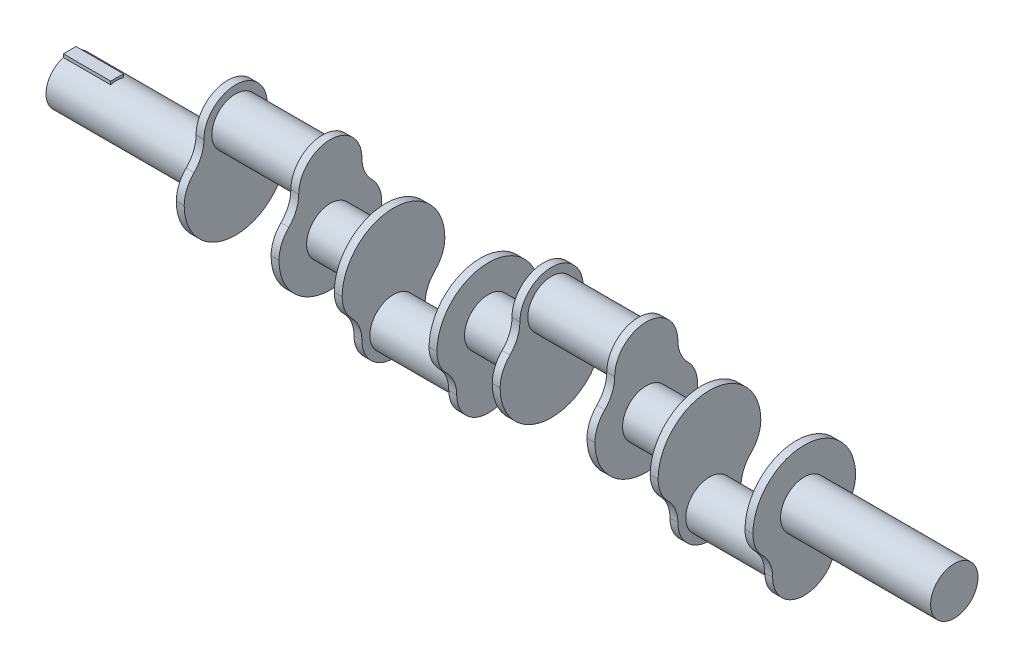
from build123d import *

# Parameters (mm, degrees)
BOSS_EXTRUDE1_DEPTH       = 320
BOSS_EXTRUDE1_DEPTH_BACK  = 240
SKETCH1_R                 = 15
BOSS_EXTRUDE2_DEPTH       = 2.5
BOSS_EXTRUDE2_DEPTH_BACK  = 2.5
BOSS_EXTRUDE2_START       = -20
BOSS_EXTRUDE4_DEPTH       = 2.5
BOSS_EXTRUDE4_DEPTH_BACK  = 2.5
BOSS_EXTRUDE4_START       = 20
BOSS_EXTRUDE5_DEPTH       = 2.5
BOSS_EXTRUDE5_DEPTH_BACK  = 2.5
BOSS_EXTRUDE5_START       = -20
SKETCH7_R                 = 15
CUT_EXTRUDE1_DEPTH        = 55
SKETCH6_R                 = 15
BOSS_EXTRUDE6_DEPTH       = 55
BOSS_EXTRUDE7_DEPTH       = 2.5
BOSS_EXTRUDE7_DEPTH_BACK  = 2.5
BOSS_EXTRUDE7_START       = 20
BOSS_EXTRUDE8_DEPTH       = 2.5
BOSS_EXTRUDE8_DEPTH_BACK  = 2.5
BOSS_EXTRUDE8_START       = -20
SKETCH11_R                = 15
CUT_EXTRUDE2_DEPTH        = 55
SKETCH10_R                = 15
BOSS_EXTRUDE11_DEPTH      = 55
BOSS_EXTRUDE12_DEPTH      = 2.5
BOSS_EXTRUDE12_DEPTH_BACK = 2.5
BOSS_EXTRUDE12_START      = 20
BOSS_EXTRUDE13_DEPTH      = 2.5
BOSS_EXTRUDE13_DEPTH_BACK = 2.5
BOSS_EXTRUDE13_START      = 80
SKETCH15_R                = 15
CUT_EXTRUDE3_DEPTH        = 55
SKETCH14_R                = 15
BOSS_EXTRUDE14_DEPTH      = 55
BOSS_EXTRUDE15_DEPTH      = 2.5
BOSS_EXTRUDE15_DEPTH_BACK = 2.5
BOSS_EXTRUDE15_START      = -80
SKETCH19_R                = 15
CUT_EXTRUDE4_DEPTH        = 55
BOSS_EXTRUDE16_REACH      = 460.891
SKETCH18_R                = 15
SKETCH23_W                = 8
SKETCH23_H                = 6
BOSS_EXTRUDE17_DEPTH      = 30


with BuildPart() as part:
    # Sketch1 → Boss-Extrude1 (new, two sides: drawn at the far end of the back side and taken through both)
    with BuildSketch(Plane(origin=(0, 0, 0), x_dir=(0, 0, -1), z_dir=(1, 0, 0)).offset(-BOSS_EXTRUDE1_DEPTH_BACK)):
        Circle(SKETCH1_R)
    extrude(amount=BOSS_EXTRUDE1_DEPTH + BOSS_EXTRUDE1_DEPTH_BACK)

    # Sketch3 → Boss-Extrude2 (add, two sides: drawn at the far end of the back side and taken through both)
    with BuildSketch(Plane(origin=(-57.5, 0, 0), x_dir=(0, 0, -1), z_dir=(1, 0, 0)).offset(BOSS_EXTRUDE2_START - BOSS_EXTRUDE2_DEPTH_BACK)):
        with BuildLine():
            ThreePointArc((-32.5, 0), (0, -32.5), (32.5, 0))
            ThreePointArc((32.5, 0), (30.875, 8.125), (26.25, 15))
            ThreePointArc((26.25, 15), (21.625, 21.875), (20, 30))
            ThreePointArc((20, 30), (0, 50), (-20, 30))
            ThreePointArc((-20, 30), (-21.625, 21.875), (-26.25, 15))
            ThreePointArc((-26.25, 15), (-30.875, 8.125), (-32.5, 0))
        make_face()
    extrude(amount=BOSS_EXTRUDE2_DEPTH + BOSS_EXTRUDE2_DEPTH_BACK)

    # Sketch4 → Boss-Extrude4 (add, two sides: drawn at the far end of the back side and taken through both)
    with BuildSketch(Plane(origin=(-57.5, 0, 0), x_dir=(0, 0, -1), z_dir=(1, 0, 0)).offset(BOSS_EXTRUDE4_START - BOSS_EXTRUDE4_DEPTH_BACK)):
        with BuildLine():
            ThreePointArc((-32.5, 0), (0, 32.5), (32.5, 0))
            ThreePointArc((32.5, 0), (30.875, -8.125), (26.25, -15))
            ThreePointArc((26.25, -15), (21.625, -21.875), (20, -30))
            ThreePointArc((20, -30), (0, -50), (-20, -30))
            ThreePointArc((-20, -30), (-21.625, -21.875), (-26.25, -15))
            ThreePointArc((-26.25, -15), (-30.875, -8.125), (-32.5, 0))
        make_face()
    extrude(amount=BOSS_EXTRUDE4_DEPTH + BOSS_EXTRUDE4_DEPTH_BACK)

    # Sketch5 → Boss-Extrude5 (add, two sides: drawn at the far end of the back side and taken through both)
    with BuildSketch(Plane(origin=(42.5, 0, 0), x_dir=(0, 0, -1), z_dir=(1, 0, 0)).offset(BOSS_EXTRUDE5_START - BOSS_EXTRUDE5_DEPTH_BACK)):
        with BuildLine():
            ThreePointArc((-32.5, 0), (0, 32.5), (32.5, 0))
            ThreePointArc((32.5, 0), (30.875, -8.125), (26.25, -15))
            ThreePointArc((26.25, -15), (21.625, -21.875), (20, -30))
            ThreePointArc((20, -30), (0, -50), (-20, -30))
            ThreePointArc((-20, -30), (-21.625, -21.875), (-26.25, -15))
            ThreePointArc((-26.25, -15), (-30.875, -8.125), (-32.5, 0))
        make_face()
    extrude(amount=BOSS_EXTRUDE5_DEPTH + BOSS_EXTRUDE5_DEPTH_BACK)

    # Sketch7 → Cut-Extrude1 (cut)
    with BuildSketch(Plane(origin=(-35, 0, 0), x_dir=(0, 0, -1), z_dir=(1, 0, 0))):
        Circle(SKETCH7_R)
    extrude(amount=CUT_EXTRUDE1_DEPTH, mode=Mode.SUBTRACT)


with BuildPart() as cut_extrude1_piece_1:
    # of the separate pieces the step leaves, piece 1, a body of its own (cut_extrude1_pieces)
    add(part.part.solids().sort_by_distance((20, -15, 26.25))[0])



with BuildPart() as cut_extrude1_piece_2:
    # of the separate pieces the step leaves, piece 2, a body of its own (cut_extrude1_pieces)
    add(part.part.solids().sort_by_distance((-35, -15, 26.25))[0])


with BuildPart() as cut_extrude1_piece_1_1:
    add(cut_extrude1_piece_1.part)

    add(cut_extrude1_piece_2.part)  # Boss-Extrude6 merges Cut-Extrude1 piece 2
    # Sketch6 → Boss-Extrude6 (add)
    with BuildSketch(Plane(origin=(-35, 0, 0), x_dir=(0, 0, -1), z_dir=(1, 0, 0))):
        with Locations(Location((0, -30, 0), (0, 0, 180))):
            Circle(SKETCH6_R)
    extrude(amount=BOSS_EXTRUDE6_DEPTH)

    # Sketch8 → Boss-Extrude7 (add, two sides: drawn at the far end of the back side and taken through both)
    with BuildSketch(Plane(origin=(42.5, 0, 0), x_dir=(0, 0, -1), z_dir=(1, 0, 0)).offset(BOSS_EXTRUDE7_START - BOSS_EXTRUDE7_DEPTH_BACK)):
        with BuildLine():
            ThreePointArc((-20, 30), (0, 50), (20, 30))
            ThreePointArc((20, 30), (21.625, 21.875), (26.25, 15))
            ThreePointArc((26.25, 15), (30.875, 8.125), (32.5, 0))
            ThreePointArc((32.5, 0), (0, -32.5), (-32.5, 0))
            ThreePointArc((-32.5, 0), (-30.875, 8.125), (-26.25, 15))
            ThreePointArc((-26.25, 15), (-21.625, 21.875), (-20, 30))
        make_face()
    extrude(amount=BOSS_EXTRUDE7_DEPTH + BOSS_EXTRUDE7_DEPTH_BACK)

    # Sketch9 → Boss-Extrude8 (add, two sides: drawn at the far end of the back side and taken through both)
    with BuildSketch(Plane(origin=(142.5, 0, 0), x_dir=(0, 0, -1), z_dir=(1, 0, 0)).offset(BOSS_EXTRUDE8_START - BOSS_EXTRUDE8_DEPTH_BACK)):
        with BuildLine():
            ThreePointArc((-20, 30), (0, 50), (20, 30))
            ThreePointArc((20, 30), (21.625, 21.875), (26.25, 15))
            ThreePointArc((26.25, 15), (30.875, 8.125), (32.5, 0))
            ThreePointArc((32.5, 0), (0, -32.5), (-32.5, 0))
            ThreePointArc((-32.5, 0), (-30.875, 8.125), (-26.25, 15))
            ThreePointArc((-26.25, 15), (-21.625, 21.875), (-20, 30))
        make_face()
    extrude(amount=BOSS_EXTRUDE8_DEPTH + BOSS_EXTRUDE8_DEPTH_BACK)

    # Sketch11 → Cut-Extrude2 (cut)
    with BuildSketch(Plane(origin=(65, 0, 0), x_dir=(0, 0, -1), z_dir=(1, 0, 0))):
        Circle(SKETCH11_R)
    extrude(amount=CUT_EXTRUDE2_DEPTH, mode=Mode.SUBTRACT)


with BuildPart() as cut_extrude2_piece_1:
    # of the separate pieces the step leaves, piece 1, a body of its own (cut_extrude2_pieces)
    add(cut_extrude1_piece_1_1.part.solids().sort_by_distance((-35, -15, 26.25))[0])



with BuildPart() as cut_extrude2_piece_2:
    # of the separate pieces the step leaves, piece 2, a body of its own (cut_extrude2_pieces)
    add(cut_extrude1_piece_1_1.part.solids().sort_by_distance((120, 0, 32.5))[0])


with BuildPart() as cut_extrude2_piece_1_1:
    add(cut_extrude2_piece_1.part)

    add(cut_extrude2_piece_2.part)  # Boss-Extrude11 merges Cut-Extrude2 piece 2
    # Sketch10 → Boss-Extrude11 (add)
    with BuildSketch(Plane(origin=(65, 0, 0), x_dir=(0, 0, -1), z_dir=(1, 0, 0))):
        with Locations((0, 30)):
            Circle(SKETCH10_R)
    extrude(amount=BOSS_EXTRUDE11_DEPTH)

    # Sketch12 → Boss-Extrude12 (add, two sides: drawn at the far end of the back side and taken through both)
    with BuildSketch(Plane(origin=(142.5, 0, 0), x_dir=(0, 0, -1), z_dir=(1, 0, 0)).offset(BOSS_EXTRUDE12_START - BOSS_EXTRUDE12_DEPTH_BACK)):
        with BuildLine():
            ThreePointArc((-20, -30), (0, -50), (20, -30))
            ThreePointArc((20, -30), (21.625, -21.875), (26.25, -15))
            ThreePointArc((26.25, -15), (30.875, -8.125), (32.5, 0))
            ThreePointArc((32.5, 0), (0, 32.5), (-32.5, 0))
            ThreePointArc((-32.5, 0), (-30.875, -8.125), (-26.25, -15))
            ThreePointArc((-26.25, -15), (-21.625, -21.875), (-20, -30))
        make_face()
    extrude(amount=BOSS_EXTRUDE12_DEPTH + BOSS_EXTRUDE12_DEPTH_BACK)

    # Sketch13 → Boss-Extrude13 (add, two sides: drawn at the far end of the back side and taken through both)
    with BuildSketch(Plane(origin=(142.5, 0, 0), x_dir=(0, 0, -1), z_dir=(1, 0, 0)).offset(BOSS_EXTRUDE13_START - BOSS_EXTRUDE13_DEPTH_BACK)):
        with BuildLine():
            ThreePointArc((-32.5, 0), (0, 32.5), (32.5, 0))
            ThreePointArc((32.5, 0), (30.875, -8.125), (26.25, -15))
            ThreePointArc((26.25, -15), (21.625, -21.875), (20, -30))
            ThreePointArc((20, -30), (0, -50), (-20, -30))
            ThreePointArc((-20, -30), (-21.625, -21.875), (-26.25, -15))
            ThreePointArc((-26.25, -15), (-30.875, -8.125), (-32.5, 0))
        make_face()
    extrude(amount=BOSS_EXTRUDE13_DEPTH + BOSS_EXTRUDE13_DEPTH_BACK)

    # Sketch15 → Cut-Extrude3 (cut)
    with BuildSketch(Plane(origin=(165, 0, 0), x_dir=(0, 0, -1), z_dir=(1, 0, 0))):
        Circle(SKETCH15_R)
    extrude(amount=CUT_EXTRUDE3_DEPTH, mode=Mode.SUBTRACT)


with BuildPart() as cut_extrude3_piece_1:
    # of the separate pieces the step leaves, piece 1, a body of its own (cut_extrude3_pieces)
    add(cut_extrude2_piece_1_1.part.solids().sort_by_distance((120, 0, 32.5))[0])



with BuildPart() as cut_extrude3_piece_2:
    # of the separate pieces the step leaves, piece 2, a body of its own (cut_extrude3_pieces)
    add(cut_extrude2_piece_1_1.part.solids().sort_by_distance((220, -15, 26.25))[0])


with BuildPart() as cut_extrude3_piece_1_1:
    add(cut_extrude3_piece_1.part)

    add(cut_extrude3_piece_2.part)  # Boss-Extrude14 merges Cut-Extrude3 piece 2
    # Sketch14 → Boss-Extrude14 (add)
    with BuildSketch(Plane(origin=(165, 0, 0), x_dir=(0, 0, -1), z_dir=(1, 0, 0))):
        with Locations((0, -30)):
            Circle(SKETCH14_R)
    extrude(amount=BOSS_EXTRUDE14_DEPTH)

    # Sketch17 → Boss-Extrude15 (add, two sides: drawn at the far end of the back side and taken through both)
    with BuildSketch(Plane(origin=(-57.5, 0, 0), x_dir=(0, 0, -1), z_dir=(1, 0, 0)).offset(BOSS_EXTRUDE15_START - BOSS_EXTRUDE15_DEPTH_BACK)):
        with BuildLine():
            ThreePointArc((-20, 30), (0, 50), (20, 30))
            ThreePointArc((20, 30), (21.625, 21.875), (26.25, 15))
            ThreePointArc((26.25, 15), (30.875, 8.125), (32.5, 0))
            ThreePointArc((32.5, 0), (0, -32.5), (-32.5, 0))
            ThreePointArc((-32.5, 0), (-30.875, 8.125), (-26.25, 15))
            ThreePointArc((-26.25, 15), (-21.625, 21.875), (-20, 30))
        make_face()
    extrude(amount=BOSS_EXTRUDE15_DEPTH + BOSS_EXTRUDE15_DEPTH_BACK)

    # Sketch19 → Cut-Extrude4 (cut)
    with BuildSketch(Plane(origin=(-135, 0, 0), x_dir=(0, 0, -1), z_dir=(1, 0, 0))):
        Circle(SKETCH19_R)
    extrude(amount=CUT_EXTRUDE4_DEPTH, mode=Mode.SUBTRACT)


with BuildPart() as cut_extrude4_piece_1:
    # of the separate pieces the step leaves, piece 1, a body of its own (cut_extrude4_pieces)
    add(cut_extrude3_piece_1_1.part.solids().sort_by_distance((220, -15, 26.25))[0])

    # Sketch18 → Boss-Extrude16 (add, up to next)
    with BuildSketch(Plane(origin=(-135, 0, 0), x_dir=(0, 0, -1), z_dir=(1, 0, 0)), mode=Mode.PRIVATE) as boss_extrude16_sk1:
        with Locations((0, 30)):
            Circle(SKETCH18_R)
    boss_extrude16_tool1 = extrude(boss_extrude16_sk1.sketch, amount=BOSS_EXTRUDE16_REACH, mode=Mode.PRIVATE) - cut_extrude4_piece_1.part
    add(boss_extrude16_tool1.solids().sort_by_distance((-135, 30, 0))[0])


with BuildPart() as cut_extrude4_piece_2:
    # of the separate pieces the step leaves, piece 2, a body of its own (cut_extrude4_pieces)
    add(cut_extrude3_piece_1_1.part.solids().sort_by_distance((-135, 0, 32.5))[0])

    # Sketch22 → Tap Drill for M12 Tap1 (revolve, cut)
    with BuildSketch(Plane(origin=(-240, 0, 0), x_dir=(0, 0, 1), z_dir=(0, 1, 0))):
        Polygon((0, 0), (0, 33.064389157), (5.1, 30), (5.1, 0), align=None)
    revolve(axis=Axis((-246.35, 0, 0), (1, 0, 0)), mode=Mode.SUBTRACT)

    # Sketch23 → Boss-Extrude17 (add)
    with BuildSketch(Plane.ZY.offset(240)):
        with Locations((0, 13.5)):
            Rectangle(SKETCH23_W, SKETCH23_H)
    extrude(amount=-BOSS_EXTRUDE17_DEPTH)


solid = Compound([cut_extrude4_piece_1.part, cut_extrude4_piece_2.part])
